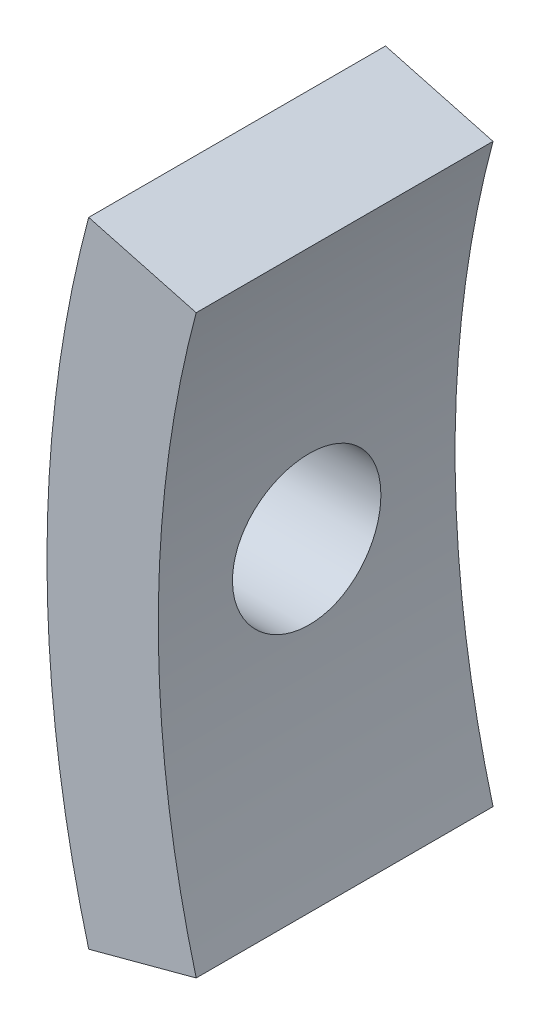
from build123d import *

# Parameters (mm, degrees)
BOSS_EXTRUDE1_DEPTH     = 10
CUT_EXTRUDE1_DEPTH      = 44.76694614
CUT_EXTRUDE1_DEPTH_BACK = 44.76694614
SKETCH2_R               = 2.5


with BuildPart() as part:
    # Sketch1 → Boss-Extrude1 (new body)
    with BuildSketch(Plane(origin=(0, 0, 0), x_dir=(0, 1, 0), z_dir=(0, 0, 1))):
        with BuildLine():
            Line((-10.67628561, 39.844440334), (-9.705714191, 36.222218486))
            ThreePointArc((-9.705714191, 36.222218486), (0, 37.5), (9.705714191, 36.222218486))
            Line((9.705714191, 36.222218486), (10.67628561, 39.844440334))
            ThreePointArc((10.67628561, 39.844440334), (0, 41.25), (-10.67628561, 39.844440334))
        make_face()
    extrude(amount=BOSS_EXTRUDE1_DEPTH)

    # Sketch2 → Cut-Extrude1 (cut, two sides: drawn at the far end of the back side and taken through both)
    with BuildSketch(Plane.YZ.offset(-CUT_EXTRUDE1_DEPTH_BACK)):
        with Locations(Location((0, 5, 0), (0, 0, 270))):
            Circle(SKETCH2_R)
    extrude(amount=CUT_EXTRUDE1_DEPTH + CUT_EXTRUDE1_DEPTH_BACK, mode=Mode.SUBTRACT)


solid = part.part
